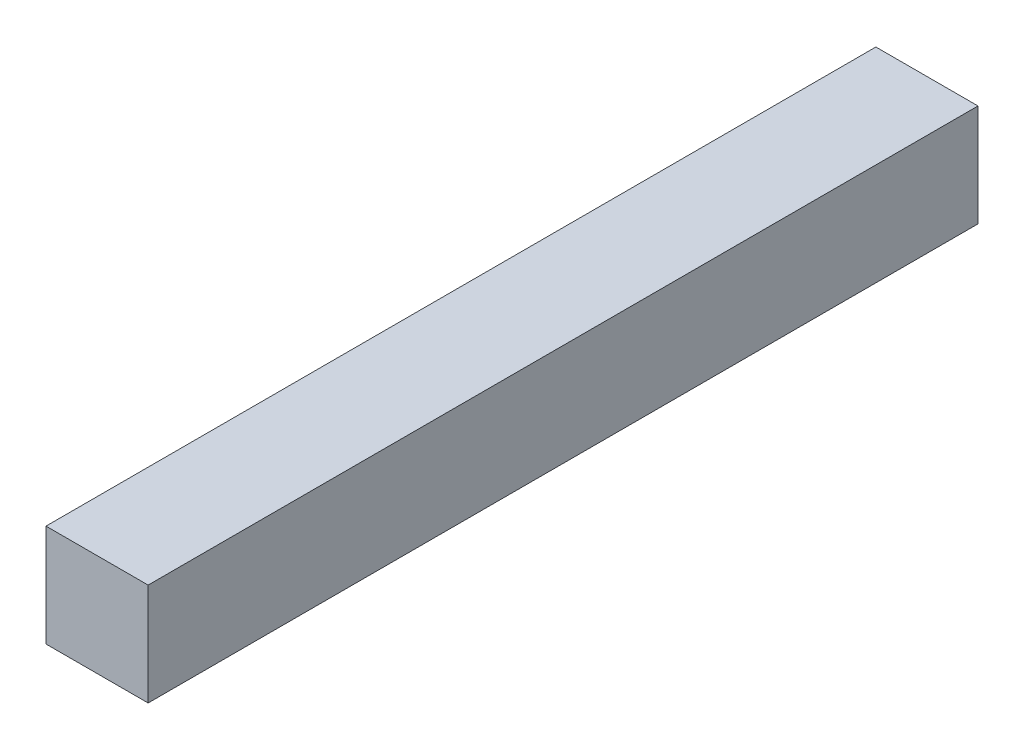
from build123d import *

# Parameters (mm, degrees)
SKICA1_W                 = 0.8
SKICA1_H                 = 0.8
P_IDAT_VYSUNUT_M1_DEPTH  = 17
SKICA2_W                 = 0.8
SKICA2_H                 = 0.8
ODEBRAT_VYSUNUT_M2_DEPTH = 3
SKICA3_W                 = 0.8
SKICA3_H                 = 0.8
ODEBRAT_VYSUNUT_M3_DEPTH = 7.5


with BuildPart() as part:
    # Skica1 → Přidat vysunutím1 (new body)
    with BuildSketch(Plane.XY):
        with Locations((0.4, 0.4)):
            Rectangle(SKICA1_W, SKICA1_H)
    extrude(amount=P_IDAT_VYSUNUT_M1_DEPTH)

    # Skica2 → Odebrat vysunutím2 (cut)
    with BuildSketch(Plane(origin=(0, 0, 0), x_dir=(-1, 0, 0), z_dir=(0, 0, -1))):
        with Locations((-0.4, 0.4)):
            Rectangle(SKICA2_W, SKICA2_H)
    extrude(amount=-ODEBRAT_VYSUNUT_M2_DEPTH, mode=Mode.SUBTRACT)

    # Skica3 → Odebrat vysunutím3 (cut)
    with BuildSketch(Plane.XY.offset(17)):
        with Locations((0.4, 0.4)):
            Rectangle(SKICA3_W, SKICA3_H)
    extrude(amount=-ODEBRAT_VYSUNUT_M3_DEPTH, mode=Mode.SUBTRACT)


solid = part.part
